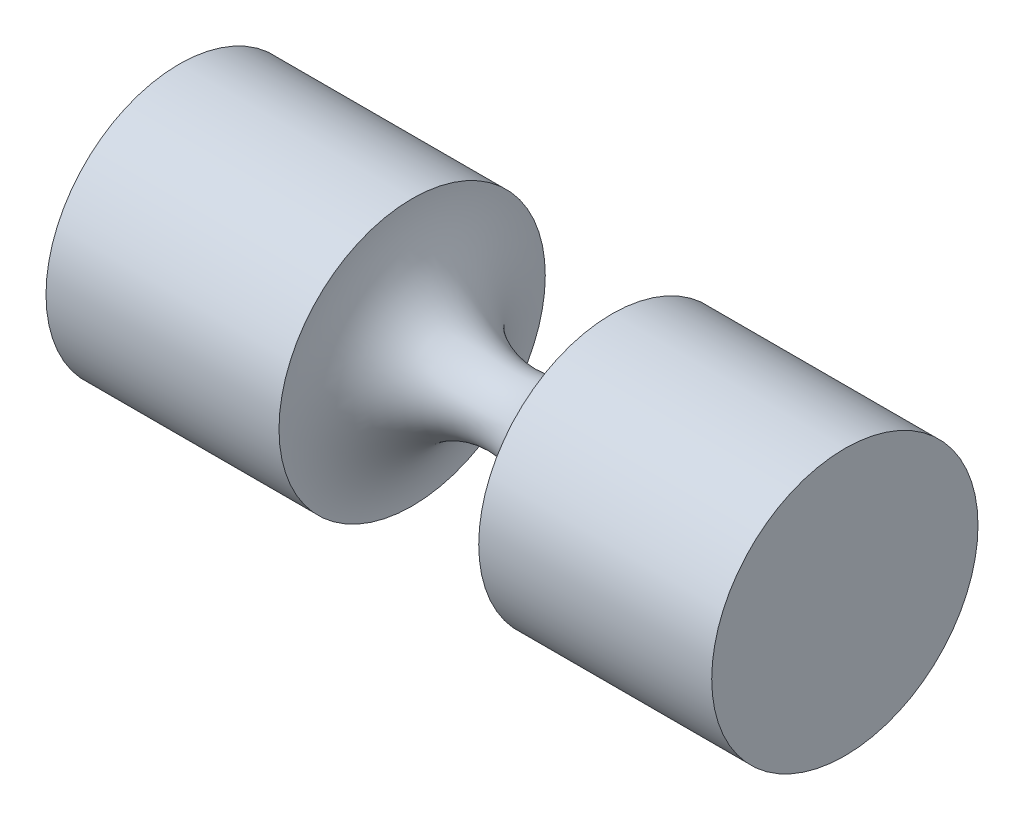
from build123d import *

# Parameters (mm, degrees)
SCALE3_SCALE = 2


with BuildPart() as part:
    # Sketch1 → Revolve1 (revolve)
    with BuildSketch(Plane(origin=(0, 0, 0), x_dir=(1, 0, 0), z_dir=(0, 1, 0))):
        with BuildLine():
            Line((0, 0), (0, 20))
            Line((0, 20), (35, 20))
            ThreePointArc((35, 20), (50, 5), (65, 20))
            Line((65, 20), (100, 20))
            Line((100, 20), (100, 0))
            Line((100, 0), (0, 0))
        make_face()
    revolve(axis=Axis((100, 0, 0), (-1, 0, 0)))


with BuildPart() as part_1:
    # Scale3: scaled about (0, 0, 0)
    add(part.part.scale(SCALE3_SCALE))


solid = part_1.part
